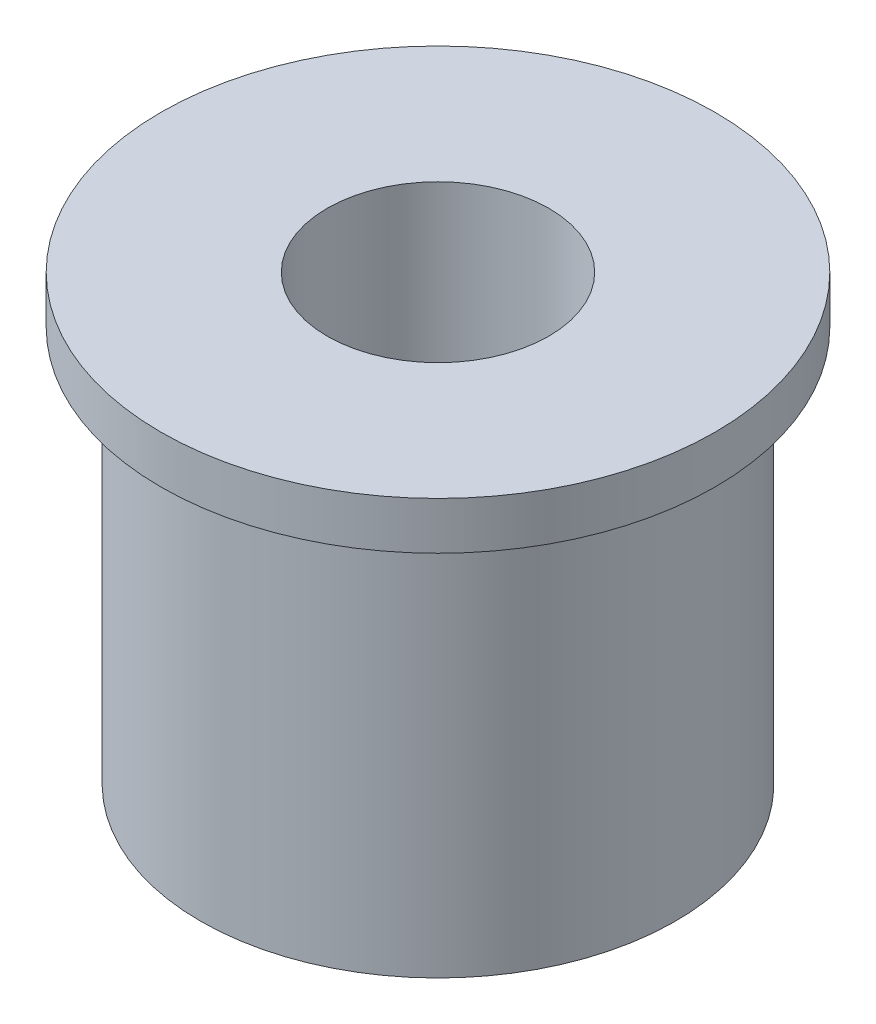
from build123d import *

# Parameters (mm, degrees)
SKETCH1_R           = 3
SKETCH1_R_2         = 1.4
BOSS_EXTRUDE1_DEPTH = 5
SKETCH2_R           = 3.5
SKETCH2_R_2         = 1.4
BOSS_EXTRUDE2_DEPTH = 0.6


with BuildPart() as part:
    # Sketch1 → Boss-Extrude1 (new body)
    with BuildSketch(Plane(origin=(0, 0, 0), x_dir=(1, 0, 0), z_dir=(0, 1, 0))):
        with Locations(Location((0, 0, 0), (0, 0, 270))):
            Circle(SKETCH1_R)
        with Locations(Location((0, 0, 0), (0, 0, 270))):
            Circle(SKETCH1_R_2, mode=Mode.SUBTRACT)
    extrude(amount=BOSS_EXTRUDE1_DEPTH)

    # Sketch2 → Boss-Extrude2 (add)
    with BuildSketch(Plane(origin=(0, 5, 0), x_dir=(1, 0, 0), z_dir=(0, 1, 0))):
        with Locations(Location((0, 0, 0), (0, 0, 270))):
            Circle(SKETCH2_R)
        with Locations(Location((0, 0, 0), (0, 0, 270))):
            Circle(SKETCH2_R_2, mode=Mode.SUBTRACT)
    extrude(amount=BOSS_EXTRUDE2_DEPTH)


solid = part.part
